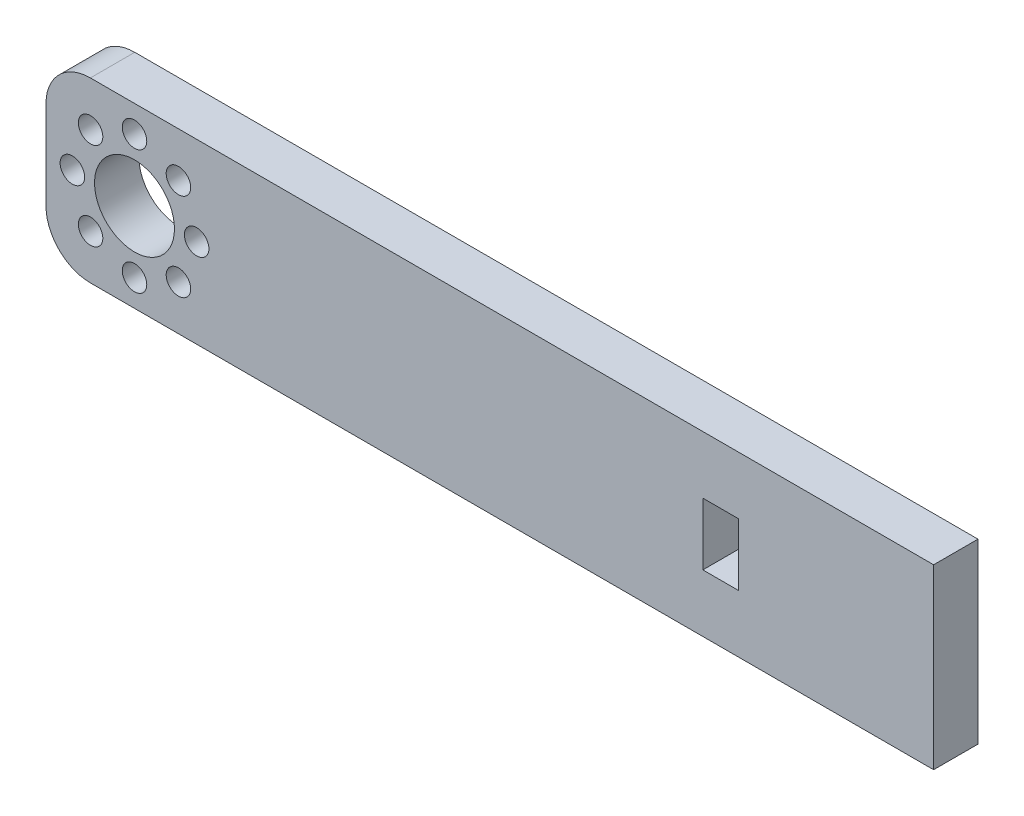
from build123d import *

# Parameters (mm, degrees)
SKETCH1_W           = 120
SKETCH1_H           = 20
BOSS_EXTRUDE1_DEPTH = 5
FILLET1_R           = 5
SKETCH3_R           = 4.5
SKETCH3_R_2         = 1.3805661
CUT_EXTRUDE2_DEPTH  = 17
SKETCH4_W           = 20
SKETCH4_H           = 20
CUT_EXTRUDE3_DEPTH  = 20
SKETCH6_W           = 4
SKETCH6_H           = 7
CUT_EXTRUDE4_DEPTH  = 20


with BuildPart() as part:
    # Sketch1 → Boss-Extrude1 (new body)
    with BuildSketch(Plane.XY):
        Rectangle(SKETCH1_W, SKETCH1_H)
    extrude(amount=BOSS_EXTRUDE1_DEPTH)

    # Fillet1
    fillet1_edges = [part.edges().sort_by_distance(p)[0] for p in [
        (-60, -10, 2.5),
        (-60, 10, 2.5),
    ]]
    fillet(fillet1_edges, radius=FILLET1_R)

    # Sketch3 → Cut-Extrude2 (cut)
    with BuildSketch(Plane.XY):
        with Locations((-50.02901078, 0)):
            Circle(SKETCH3_R)
        with Locations((-50.02901078, 7)):
            Circle(SKETCH3_R_2)
        with Locations((-45.079263311, 4.949747468)):
            Circle(SKETCH3_R_2)
        with Locations((-43.02901078, 0)):
            Circle(SKETCH3_R_2)
        with Locations((-45.079263311, -4.949747468)):
            Circle(SKETCH3_R_2)
        with Locations((-50.02901078, -7)):
            Circle(SKETCH3_R_2)
        with Locations((-54.978758248, -4.949747468)):
            Circle(SKETCH3_R_2)
        with Locations((-57.02901078, 0)):
            Circle(SKETCH3_R_2)
        with Locations((-54.978758248, 4.949747468)):
            Circle(SKETCH3_R_2)
    extrude(amount=CUT_EXTRUDE2_DEPTH, mode=Mode.SUBTRACT)

    # Sketch4 → Cut-Extrude3 (cut)
    with BuildSketch(Plane.XY):
        with Locations((50, 0)):
            Rectangle(SKETCH4_W, SKETCH4_H)
    extrude(amount=CUT_EXTRUDE3_DEPTH, mode=Mode.SUBTRACT)

    # Sketch6 → Cut-Extrude4 (cut)
    with BuildSketch(Plane.XY.offset(5)):
        with Locations((16, 0)):
            Rectangle(SKETCH6_W, SKETCH6_H)
    extrude(amount=-CUT_EXTRUDE4_DEPTH, mode=Mode.SUBTRACT)


solid = part.part
